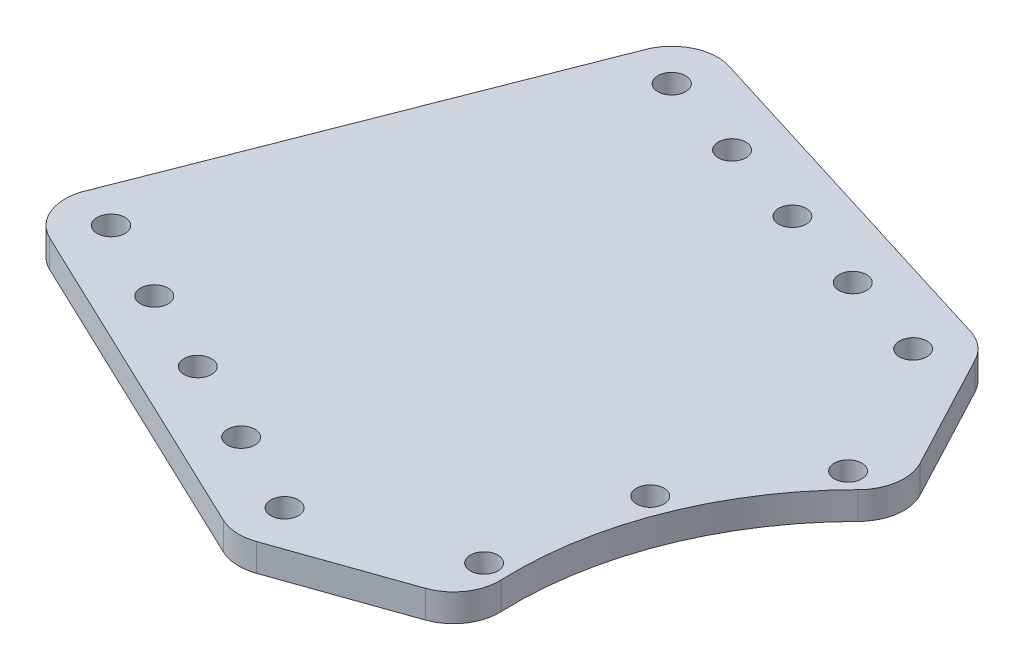
from build123d import *

# Parameters (mm, degrees)
SKETCH_2_R      = 1.5
SKETCH_2_R_2    = 1.518721219
SKETCH_2_R_3    = 1.512738874
EXTRUDE_1_DEPTH = 3


with BuildPart() as part:
    # 草图2 → 凸台-拉伸1 (new body)
    with BuildSketch(Plane(origin=(0, -12.8, 0), x_dir=(1, 0, 0), z_dir=(0, 1, 0))):
        with BuildLine():
            Line((-67.750211529, -36.977031927), (-103.858972682, -19.797438789))
            ThreePointArc((-103.858972682, -19.797438789), (-106.429442956, -16.948260564), (-106.232366674, -13.115990359))
            Line((-106.232366674, -13.115990359), (-89.185537995, 30.475859314))
            ThreePointArc((-89.185537995, 30.475859314), (-86.69601178, 33.160837283), (-83.04433662, 33.429381478))
            Line((-83.04433662, 33.429381478), (-44.860392292, 21.55641016))
            ThreePointArc((-44.860392292, 21.55641016), (-43.151818029, 20.629450998), (-41.925856607, 19.120975645))
            Line((-41.925856607, 19.120975645), (-35.176480428, 6.369645252))
            ThreePointArc((-35.176480428, 6.369645252), (-34.651006031, 3.288347657), (-36.057985487, 0.497124446))
            ThreePointArc((-36.057985487, 0.497124446), (-44.450352857, -12.346252855), (-46.996898287, -27.475670456))
            ThreePointArc((-46.996898287, -27.475670456), (-47.856649261, -30.480890326), (-50.332989366, -32.388312117))
            Line((-50.332989366, -32.388312117), (-63.942022797, -37.178376279))
            ThreePointArc((-63.942022797, -37.178376279), (-65.866066657, -37.455025022), (-67.750211529, -36.977031927))
        make_face()
        with Locations(Location((-65.602078267, -32.461998872, 0), (0, 0, 270))):
            Circle(SKETCH_2_R, mode=Mode.SUBTRACT)
        with Locations(Location((-74.632144377, -28.165732348, 0), (0, 0, 270))):
            Circle(SKETCH_2_R, mode=Mode.SUBTRACT)
        with Locations(Location((-83.662210487, -23.869465823, 0), (0, 0, 270))):
            Circle(SKETCH_2_R, mode=Mode.SUBTRACT)
        with Locations(Location((-92.692276597, -19.573199299, 0), (0, 0, 270))):
            Circle(SKETCH_2_R, mode=Mode.SUBTRACT)
        with Locations(Location((-101.704945463, -15.270017578, 0), (0, 0, 270))):
            Circle(SKETCH_2_R_2, mode=Mode.SUBTRACT)
        with Locations(Location((-84.528930836, 28.654867889, 0), (0, 0, 270))):
            Circle(SKETCH_2_R_3, mode=Mode.SUBTRACT)
        with Locations(Location((-74.992068043, 25.689461869, 0), (0, 0, 270))):
            Circle(SKETCH_2_R, mode=Mode.SUBTRACT)
        with Locations(Location((-65.443040865, 22.720273436, 0), (0, 0, 270))):
            Circle(SKETCH_2_R, mode=Mode.SUBTRACT)
        with Locations(Location((-55.894013686, 19.751085004, 0), (0, 0, 270))):
            Circle(SKETCH_2_R, mode=Mode.SUBTRACT)
        with Locations(Location((-46.344986508, 16.781896571, 0), (0, 0, 270))):
            Circle(SKETCH_2_R, mode=Mode.SUBTRACT)
        with Locations(Location((-38.368045535, 1.711376394, 0), (0, 0, 270))):
            Circle(SKETCH_2_R, mode=Mode.SUBTRACT)
        with Locations(Location((-46.778656436, -11.435757143, 0), (0, 0, 270))):
            Circle(SKETCH_2_R, mode=Mode.SUBTRACT)
        with Locations(Location((-49.517857516, -26.800726176, 0), (0, 0, 270))):
            Circle(SKETCH_2_R, mode=Mode.SUBTRACT)
    extrude(amount=EXTRUDE_1_DEPTH)


solid = part.part
